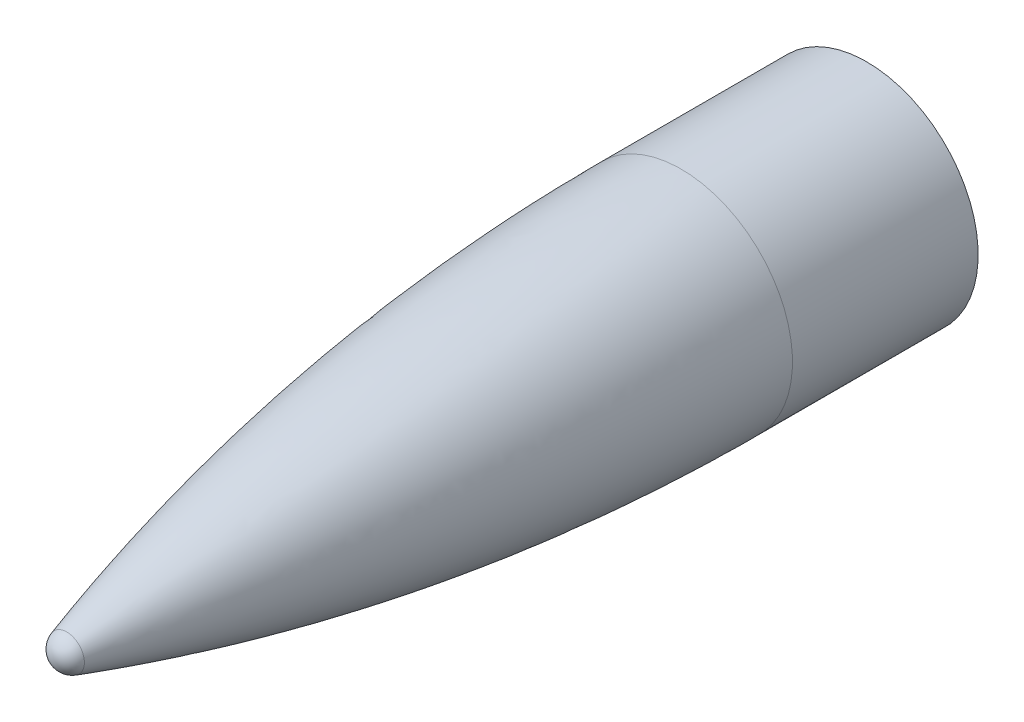
from build123d import *

# Parameters (mm, degrees)
SKETCH4_R           = 76.2
BOSS_EXTRUDE1_DEPTH = 127


with BuildPart() as part:
    # Sketch1 → Revolve1 (revolve)
    with BuildSketch(Plane(origin=(0, 0, 0), x_dir=(0, 0, -1), z_dir=(1, 0, 0))):
        with BuildLine():
            Line((457.2, 76.2), (457.2, 0))
            Line((457.2, 0), (28.102653709, 0))
            ThreePointArc((28.102653709, 0), (30.571207908, 7.523796703), (37.017223288, 12.122727273))
            add(Edge.make_bspline(
                [(37.017223288, 12.122727273), (37.52310906, 12.280694647), (38.538318559, 12.596904039), (40.816756218, 13.304771657), (42.752004479, 13.90068199), (44.596026055, 14.466308501), (47.03109181, 15.209903105), (50.064812323, 16.130247374), (54.019612263, 17.318435031), (58.888315086, 18.762040466), (64.982567727, 20.545198658), (72.30495351, 22.649547982), (80.862925362, 25.053460265), (90.662645854, 27.73012475), (99.254252227, 30.010413772), (106.629952216, 31.920646556), (114.014789381, 33.795438137), (121.408533039, 35.634724017), (134.983821777, 38.925308795), (154.786289186, 43.474238823), (194.540262792, 51.905249649), (254.60358103, 62.398393155), (312.619254535, 69.541513124), (364.55396501, 73.415790164), (394.997236841, 74.842827135), (403.879172543, 75.195044905), (408.955262717, 75.3780235), (414.031967532, 75.542711003), (419.109253724, 75.689105279), (424.186997048, 75.817204426), (428.630459668, 75.913281488), (432.439264091, 75.984196872), (435.613584089, 76.035668397), (438.152678191, 76.072270707), (440.693049904, 76.104297988), (443.230260366, 76.131750137), (445.776253825, 76.154627063), (448.296330315, 76.172928693), (450.90159068, 76.186654968), (453.222017869, 76.195805842), (455.607850756, 76.199237426), (456.670024688, 76.2), (457.2, 76.2)],
                knots=[0.083075389, 0.083075389, 0.083075389, 0.083075389, 0.083075389, 0.088043903, 0.093012418, 0.097980932, 0.100465189, 0.102949446, 0.112886475, 0.122823504, 0.132760527, 0.14269755, 0.162571597, 0.18244564, 0.202319683, 0.222193736, 0.232130762, 0.242067788, 0.261941836, 0.281815884, 0.341438021, 0.401060169, 0.579926596, 0.758793027, 0.79854112, 0.808478144, 0.818415169, 0.828352193, 0.838289217, 0.848226241, 0.858163265, 0.868100289, 0.873068801, 0.878037313, 0.883005825, 0.887974337, 0.892942848, 0.89791136, 0.902879872, 0.907848384, 0.912816896, 0.917785408, 0.917785408, 0.917785408, 0.917785408, 0.917785408], degree=4))
        make_face()
    revolve(axis=Axis((0, 0, -480.06), (0, 0, 1)))

    # Sketch4 → Boss-Extrude1 (add)
    with BuildSketch(Plane(origin=(0, 0, -457.2), x_dir=(-1, 0, 0), z_dir=(0, 0, -1))):
        Circle(SKETCH4_R)
    extrude(amount=BOSS_EXTRUDE1_DEPTH)


solid = part.part
